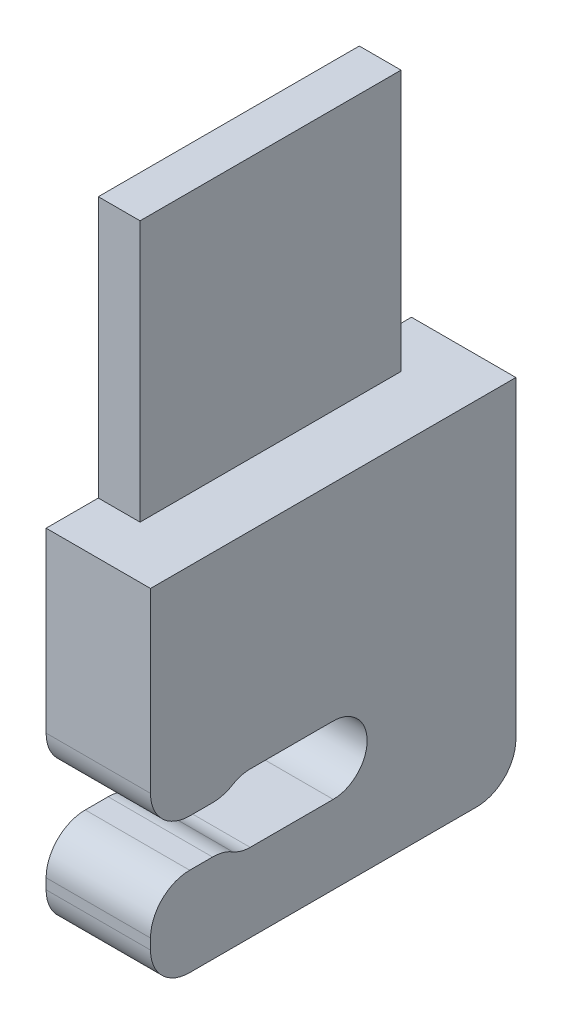
from build123d import *

# Parameters (mm, degrees)
SKETCH1_W           = 10
SKETCH1_H           = 10
BOSS_EXTRUDE1_DEPTH = 1.6
BOSS_EXTRUDE2_DEPTH = 10
SKETCH3_W           = 4
SKETCH3_H           = 2
BOSS_EXTRUDE3_DEPTH = 2
SKETCH4_W           = 4
SKETCH4_H           = 2
BOSS_EXTRUDE4_DEPTH = 2
BOSS_EXTRUDE5_DEPTH = 4
FILLET1_R           = 1.5


with BuildPart() as part:
    # Sketch1 → Boss-Extrude1 (new body)
    with BuildSketch(Plane(origin=(0, 0, 0), x_dir=(0, 0, -1), z_dir=(1, 0, 0))):
        with Locations((5, -5)):
            Rectangle(SKETCH1_W, SKETCH1_H)
    extrude(amount=BOSS_EXTRUDE1_DEPTH)

    # Sketch2 → Boss-Extrude2 (add)
    with BuildSketch(Plane.XY):
        Polygon((1.2, -12), (0, -12), (0, -10), (1.6, -10), (4, -10), (4, -12), (2.8, -12), align=None)
    extrude(amount=-BOSS_EXTRUDE2_DEPTH)

    # Sketch3 → Boss-Extrude3 (add)
    with BuildSketch(Plane.XY):
        with Locations((2, -11)):
            Rectangle(SKETCH3_W, SKETCH3_H)
    extrude(amount=BOSS_EXTRUDE3_DEPTH)

    # Sketch4 → Boss-Extrude4 (add)
    with BuildSketch(Plane(origin=(0, 0, -10), x_dir=(-1, 0, 0), z_dir=(0, 0, -1))):
        with Locations((-2, -11)):
            Rectangle(SKETCH4_W, SKETCH4_H)
    extrude(amount=BOSS_EXTRUDE4_DEPTH)

    # Sketch5 → Boss-Extrude5 (add)
    with BuildSketch(Plane(origin=(4, 0, 0), x_dir=(0, 0, -1), z_dir=(1, 0, 0))):
        with BuildLine():
            Line((12, -12), (-2, -12))
            Line((-2, -12), (-2, -16.665516671))
            Line((-2, -16.665516671), (-2, -18.3))
            Line((-2, -18.3), (0.880666042, -18.3))
            ThreePointArc((0.880666042, -18.3), (1.308847242, -18.004173926), (1.818749194, -17.9))
            Line((1.818749194, -17.9), (5, -17.9))
            ThreePointArc((5, -17.9), (5.919238816, -18.280761184), (6.3, -19.2))
            ThreePointArc((6.3, -19.2), (5.919238816, -20.119238816), (5, -20.5))
            Line((5, -20.5), (1.818749194, -20.5))
            ThreePointArc((1.818749194, -20.5), (1.308847242, -20.395826074), (0.880666042, -20.1))
            Line((0.880666042, -20.1), (-2, -20.1))
            Line((-2, -20.1), (-2, -22))
            ThreePointArc((-2, -22), (-1.560660172, -23.060660172), (-0.5, -23.5))
            Line((-0.5, -23.5), (10.5, -23.5))
            ThreePointArc((10.5, -23.5), (11.560660172, -23.060660172), (12, -22))
            Line((12, -22), (12, -12))
        make_face()
    extrude(amount=-BOSS_EXTRUDE5_DEPTH)

    # Fillet1
    fillet1_edges = [part.edges().sort_by_distance(p)[0] for p in [
        (2, -18.3, -0.880666042),
        (2, -18.3, 2),
        (2, -20.1, 2),
        (2, -20.1, -0.880666042),
    ]]
    fillet(fillet1_edges, radius=FILLET1_R)


solid = part.part
